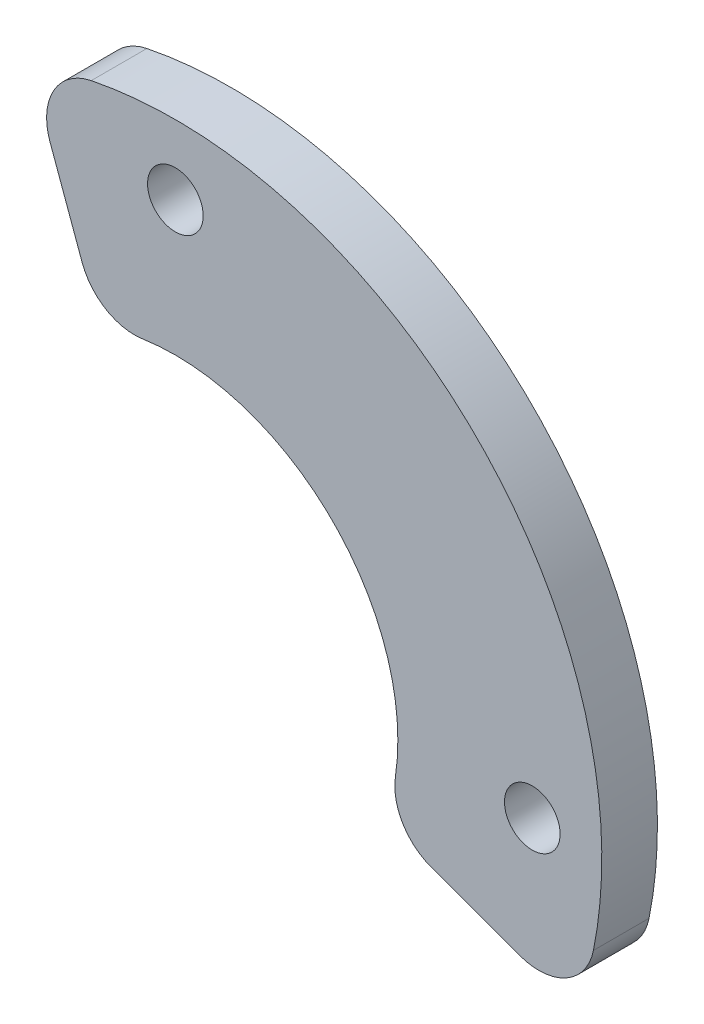
from build123d import *

# Parameters (mm, degrees)
SKETCH_1_R      = 1.5
EXTRUDE_1_DEPTH = 3
FILLET_1_R      = 3


with BuildPart() as part:
    # 草图1 → 凸台-拉伸1 (new body)
    with BuildSketch(Plane.XY):
        with BuildLine():
            Line((-7.866463296, 21.612930278), (-4.10424172, 11.276311449))
            ThreePointArc((-4.10424172, 11.276311449), (6.882917236, 9.829824531), (12, 0))
            ThreePointArc((12, 0), (11.817693036, -2.083778132), (11.276311449, -4.10424172))
            Line((11.276311449, -4.10424172), (21.612930278, -7.866463296))
            ThreePointArc((21.612930278, -7.866463296), (22.650578319, -3.993908086), (23, 0))
            ThreePointArc((23, 0), (13.192258036, 18.840497019), (-7.866463296, 21.612930278))
        make_face()
        with Locations((19.25, 0)):
            Circle(SKETCH_1_R, mode=Mode.SUBTRACT)
        with Locations((0, 19.25)):
            Circle(SKETCH_1_R, mode=Mode.SUBTRACT)
    extrude(amount=EXTRUDE_1_DEPTH)

    # 圆角1
    fillet_1_edges = [part.edges().sort_by_distance(p)[0] for p in [
        (11.276311449, -4.10424172, 1.5),
        (-4.10424172, 11.276311449, 1.5),
        (-7.866463296, 21.612930278, 1.5),
        (21.612930278, -7.866463296, 1.5),
    ]]
    fillet(fillet_1_edges, radius=FILLET_1_R)


solid = part.part
